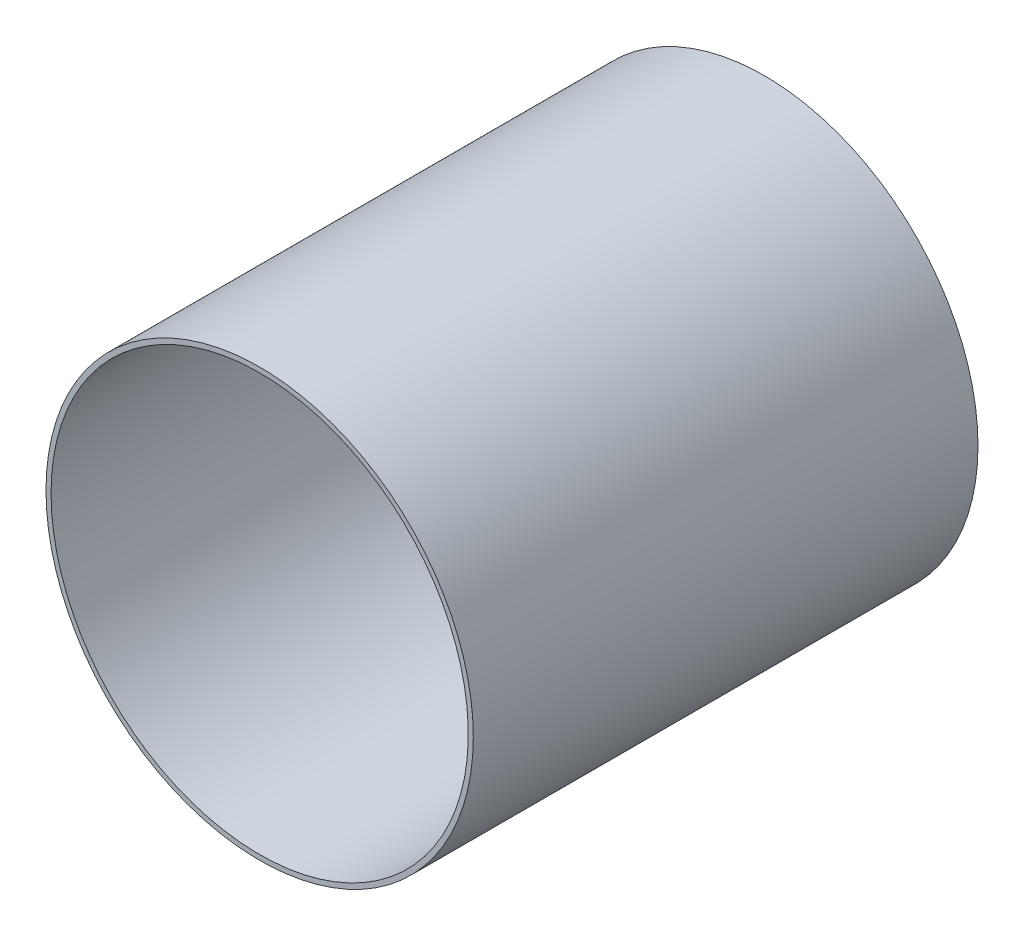
from build123d import *

# Parameters (mm, degrees)
SKETCH1_R           = 32.258
SKETCH1_R_2         = 31.5
BOSS_EXTRUDE1_DEPTH = 76.2


with BuildPart() as part:
    # Sketch1 → Boss-Extrude1 (new body)
    with BuildSketch(Plane.XY):
        with Locations(Location((0, 0, 0), (0, 0, 180))):
            Circle(SKETCH1_R)
        with Locations(Location((0, 0, 0), (0, 0, 180))):
            Circle(SKETCH1_R_2, mode=Mode.SUBTRACT)
    extrude(amount=BOSS_EXTRUDE1_DEPTH)


solid = part.part
